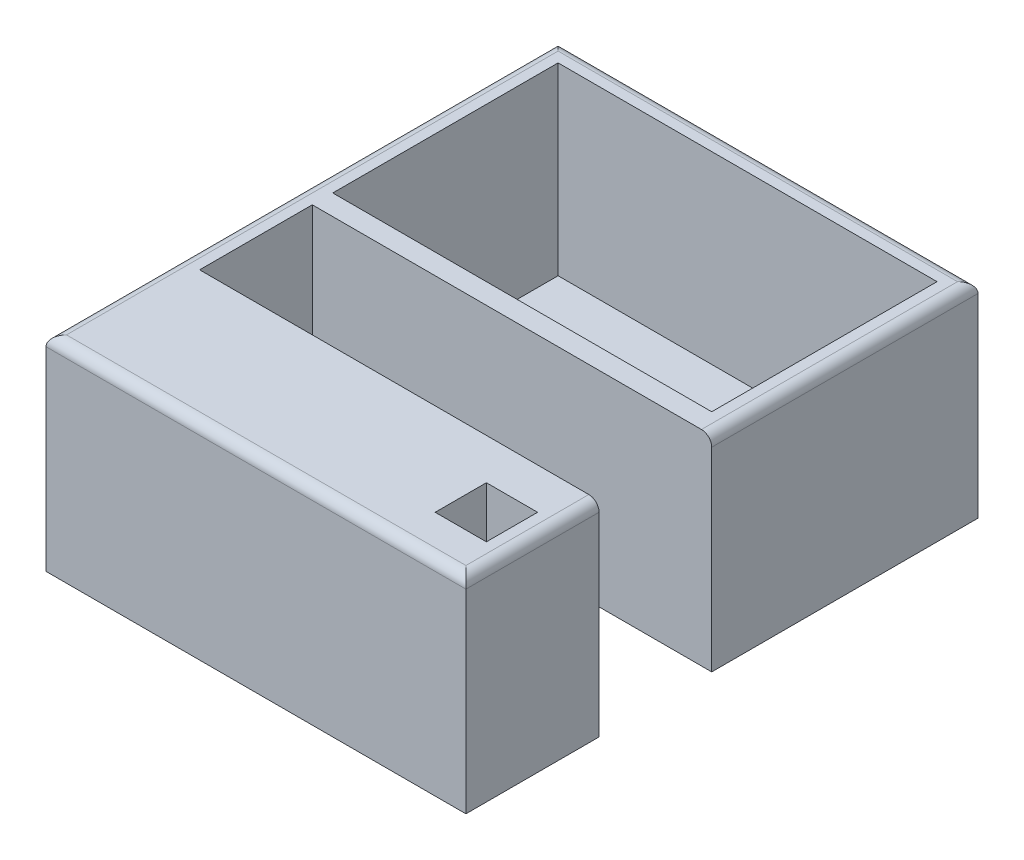
from build123d import *

# Parameters (mm, degrees)
BOSS_EXTRUDE1_DEPTH = 2
SKETCH2_W           = 5
SKETCH2_H           = 5
SKETCH2_W_2         = 37
SKETCH2_H_2         = 22
BOSS_EXTRUDE3_DEPTH = 18
SKETCH3_R           = 1.25
CUT_EXTRUDE1_DEPTH  = 38.003378224
FILLET1_R           = 1


with BuildPart() as part:
    # Sketch1 → Boss-Extrude1 (new body)
    with BuildSketch(Plane(origin=(0, 0, 0), x_dir=(1, 0, 0), z_dir=(0, 1, 0))):
        Polygon((20.5, 25), (20.5, -1), (-17.5, -1), (-17.5, -12), (20.5, -12), (20.5, -25), (-20.5, -25), (-20.5, 25), align=None)
    extrude(amount=BOSS_EXTRUDE1_DEPTH)

    # Sketch2 → Boss-Extrude3 (add)
    with BuildSketch(Plane(origin=(0, 2, 0), x_dir=(1, 0, 0), z_dir=(0, 1, 0))):
        Polygon((20.5, 25), (-20.5, 25), (-20.5, -25), (20.5, -25), (20.5, -12), (-17.5, -12), (-18.5, -12), (-18.5, -1), (-17.5, -1), (20.5, -1), align=None)
        with Locations((16, -18.5)):
            Rectangle(SKETCH2_W, SKETCH2_H, mode=Mode.SUBTRACT)
        with Locations((0, 12)):
            Rectangle(SKETCH2_W_2, SKETCH2_H_2, mode=Mode.SUBTRACT)
    extrude(amount=BOSS_EXTRUDE3_DEPTH)

    # Sketch3 → Cut-Extrude1 (cut, through all)
    with BuildSketch(Plane(origin=(0, 2, 0), x_dir=(1, 0, 0), z_dir=(0, 1, 0))):
        with Locations(Location((16, 20.5, 0), (0, 0, 270))):
            Circle(SKETCH3_R)
        with Locations(Location((16, -18.5, 0), (0, 0, 270))):
            Circle(SKETCH3_R)
    extrude(amount=-CUT_EXTRUDE1_DEPTH, mode=Mode.SUBTRACT)

    # Fillet1
    fillet1_edges = [part.edges().sort_by_distance(p)[0] for p in [
        (20.5, 20, -12),
        (0, 20, -25),
        (-20.5, 20, 0),
        (0, 20, 25),
        (20.5, 20, 18.5),
    ]]
    fillet(fillet1_edges, radius=FILLET1_R)


solid = part.part
